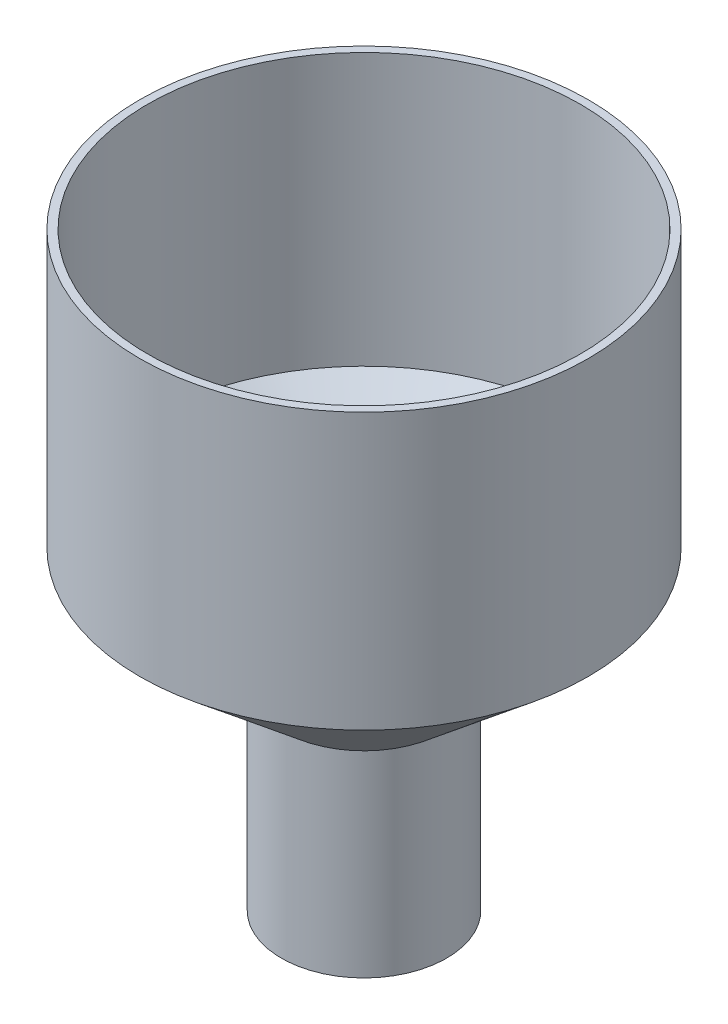
from build123d import *


with BuildPart() as part:
    # Sketch1 → Revolve1 (revolve)
    with BuildSketch(Plane.XY, mode=Mode.PRIVATE) as revolve1_sk:
        Polygon((19, -26.669257575), (19, 24.267492317), (55, 54.267492317), (55, 123.330742425), (57, 123.330742425), (57, 53.330742425), (21, 23.330742425), (21, -26.669257575), align=None)
    revolve(revolve1_sk.sketch.rotate(Axis((0, 0, 0), (0, 1, 0)), 90), axis=Axis((0, 0, 0), (0, 1, 0)))


solid = part.part
